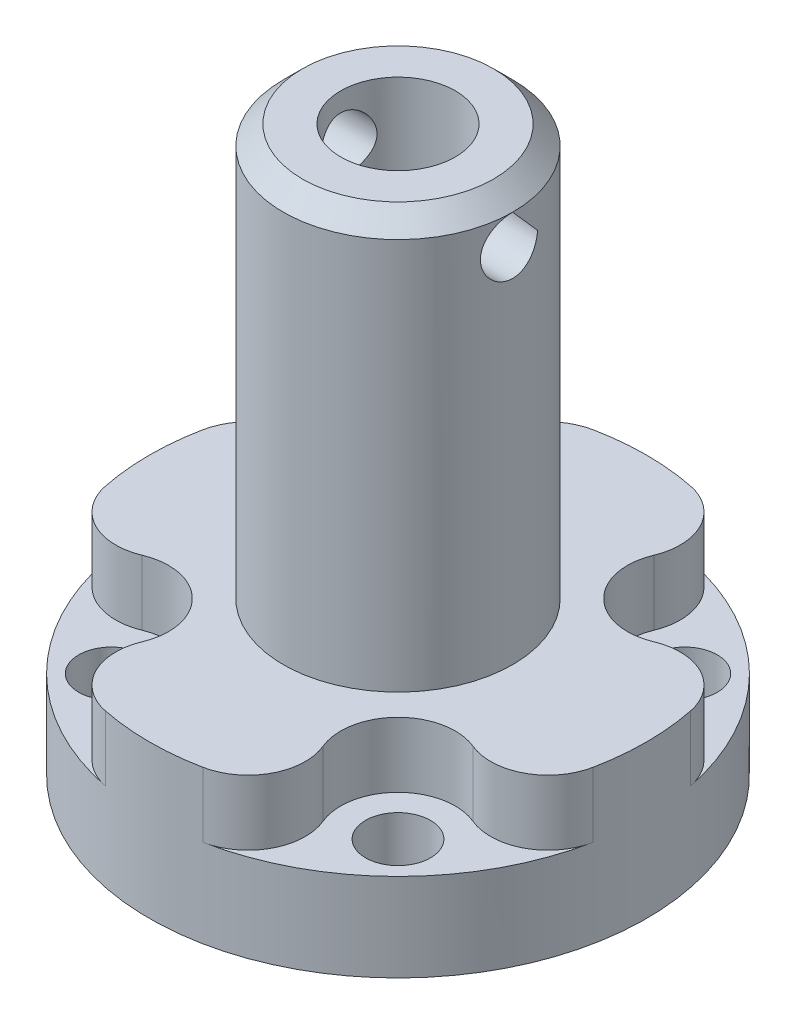
from build123d import *

# Parameters (mm, degrees)
SKETCH1_R                                            = 6
BOSS_EXTRUDE1_DEPTH                                  = 29.5
SKETCH3_R                                            = 13
BOSS_EXTRUDE2_DEPTH                                  = 8
SKETCH2_R                                            = 3
CUT_EXTRUDE1_DEPTH                                   = 35.759890679
CBORE_FOR_M3_HEXAGON_SOCKET_HEAD_CAP_SCR_D           = 3.4
CBORE_FOR_M3_HEXAGON_SOCKET_HEAD_CAP_SCR_CBORE_D     = 6
CBORE_FOR_M3_HEXAGON_SOCKET_HEAD_CAP_SCR_CBORE_DEPTH = 3.4
FILLET1_R                                            = 3
CHAMFER1_SIZE                                        = 1
CUT_EXTRUDE2_DEPTH                                   = 35.759890754
CUT_EXTRUDE2_DEPTH_BACK                              = 35.759890754
SKETCH6_R                                            = 1.5


with BuildPart() as part:
    # Sketch1 → Boss-Extrude1 (new body)
    with BuildSketch(Plane(origin=(0, 0, 0), x_dir=(1, 0, 0), z_dir=(0, 1, 0))):
        with Locations(Location((0, 0, 0), (0, 0, 270))):
            Circle(SKETCH1_R)
    extrude(amount=BOSS_EXTRUDE1_DEPTH)

    # Sketch3 → Boss-Extrude2 (add)
    with BuildSketch(Plane.XZ):
        with Locations(Location((0, 0, 0), (0, 0, 270))):
            Circle(SKETCH3_R)
    extrude(amount=-BOSS_EXTRUDE2_DEPTH)

    # Sketch2 → Cut-Extrude1 (cut, through all)
    with BuildSketch(Plane.XZ):
        with Locations(Location((0, 0, 0), (0, 0, 270))):
            Circle(SKETCH2_R)
    extrude(amount=-CUT_EXTRUDE1_DEPTH, mode=Mode.SUBTRACT)

    # CBORE for M3 Hexagon socket head cap screws1 (through all)
    with Locations(Plane(origin=(0, 8, 0), x_dir=(1, 0, 0), z_dir=(0, 1, 0))):
        with Locations((-7.5, 7.5), (-7.5, -7.5), (7.5, -7.5), (7.5, 7.5)):
            CounterBoreHole(CBORE_FOR_M3_HEXAGON_SOCKET_HEAD_CAP_SCR_D / 2, CBORE_FOR_M3_HEXAGON_SOCKET_HEAD_CAP_SCR_CBORE_D / 2, CBORE_FOR_M3_HEXAGON_SOCKET_HEAD_CAP_SCR_CBORE_DEPTH)

    # Fillet1
    fillet1_edges = [part.edges().sort_by_distance(p)[0] for p in [
        (7.671577138, 6.3, -10.495089529),
        (10.495089529, 6.3, -7.671577138),
        (7.671577138, 6.3, 10.495089529),
        (10.495089529, 6.3, 7.671577138),
        (-7.671577138, 6.3, 10.495089529),
        (-10.495089529, 6.3, 7.671577138),
        (-10.495089529, 6.3, -7.671577138),
        (-7.671577138, 6.3, -10.495089529),
    ]]
    fillet(fillet1_edges, radius=FILLET1_R)

    # Chamfer1
    chamfer1_edges = [part.edges().sort_by_distance(p)[0] for p in [
        (0, 29.5, -6),
    ]]
    chamfer(chamfer1_edges, length=CHAMFER1_SIZE)

    # Sketch6 → Cut-Extrude2 (cut, two sides: drawn at the far end of the back side and taken through both)
    with BuildSketch(Plane(origin=(0, 0, 0), x_dir=(0, 0, -1), z_dir=(1, 0, 0)).offset(-CUT_EXTRUDE2_DEPTH_BACK)):
        with Locations((0, 27)):
            Circle(SKETCH6_R)
    extrude(amount=CUT_EXTRUDE2_DEPTH + CUT_EXTRUDE2_DEPTH_BACK, mode=Mode.SUBTRACT)


solid = part.part
